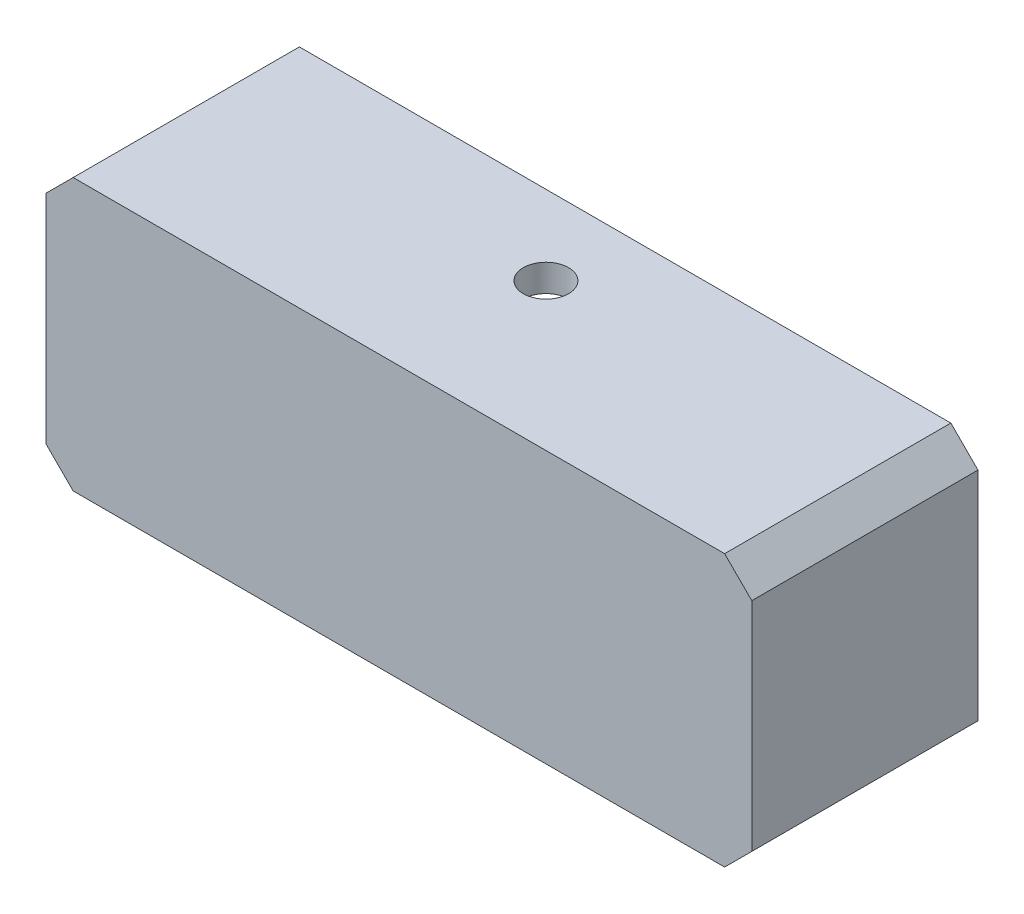
from build123d import *

# Parameters (mm, degrees)
SKETCH_1_W               = 70
SKETCH_1_H               = 20
EXTRUDE_1_DEPTH          = 3
SKETCH_2_W               = 78
SKETCH_2_H               = 30
EXTRUDE_2_DEPTH          = 3
SKETCH_4_W               = 16
SKETCH_4_H               = 12
SKETCH_4_W_2             = 9.1
SKETCH_4_H_2             = 6.5
EXTRUDE_3_DEPTH          = 22
SKETCH_5_W               = 46
SKETCH_5_H               = 3
EXTRUDE_4_DEPTH          = 22
EXTRUDE_5_DEPTH          = 22
CHAMFER_1_SIZE           = 3
CUT_EXTRUDE_1_DEPTH      = 82.786306922
CUT_EXTRUDE_1_DEPTH_BACK = 82.786306922
SKETCH_10_R              = 2.5
SKETCH_11_R              = 1.65
CUT_EXTRUDE_2_DEPTH      = 10


with BuildPart() as part:
    # 草图1 → 凸台-拉伸1 (new body)
    with BuildSketch(Plane.XY):
        with Locations((35, 10)):
            Rectangle(SKETCH_1_W, SKETCH_1_H)
    extrude(amount=EXTRUDE_1_DEPTH)

    # 草图2 → 凸台-拉伸2 (add)
    with BuildSketch(Plane.XY.offset(3)):
        with Locations((35, 12)):
            Rectangle(SKETCH_2_W, SKETCH_2_H)
    extrude(amount=-EXTRUDE_2_DEPTH)

    # 草图4 → 凸台-拉伸3 (add)
    with BuildSketch(Plane(origin=(0, 0, 0), x_dir=(-1, 0, 0), z_dir=(0, 0, -1))):
        with Locations((-66, 3)):
            Rectangle(SKETCH_4_W, SKETCH_4_H)
        with Locations((-65.45, 3.25)):
            Rectangle(SKETCH_4_W_2, SKETCH_4_H_2, mode=Mode.SUBTRACT)
    extrude_3 = extrude(amount=EXTRUDE_3_DEPTH)

    # 镜向1: 凸台-拉伸3 across plane
    add(extrude_3.mirror(Plane(origin=(35, 0, 0), x_dir=(0, 0, 1), z_dir=(1, 0, 0))))

    # 草图5 → 凸台-拉伸4 (add)
    with BuildSketch(Plane(origin=(0, 0, 0), x_dir=(-1, 0, 0), z_dir=(0, 0, -1))):
        with Locations((-35, -1.5)):
            Rectangle(SKETCH_5_W, SKETCH_5_H)
    extrude(amount=EXTRUDE_4_DEPTH)

    # 草图6 → 凸台-拉伸5 (add)
    with BuildSketch(Plane(origin=(0, 0, 0), x_dir=(-1, 0, 0), z_dir=(0, 0, -1))):
        Polygon((4, 27), (-74, 27), (-74, 24), (-74, 9), (-71, 9), (-71, 24), (1, 24), (1, 9), (4, 9), (4, 24), align=None)
    extrude(amount=EXTRUDE_5_DEPTH)

    # 倒角1
    chamfer_1_edges = [part.edges().sort_by_distance(p)[0] for p in [
        (-4, -3, -9.5),
        (-4, 27, -9.5),
        (74, 27, -9.5),
        (74, -3, -9.5),
    ]]
    chamfer(chamfer_1_edges, length=CHAMFER_1_SIZE)

    # 草图10 → 切除-拉伸1 (cut, two sides: drawn at the far end of the back side and taken through both)
    with BuildSketch(Plane.XZ.offset(-24).offset(-CUT_EXTRUDE_1_DEPTH_BACK)):
        with Locations((35, -13.25)):
            Circle(SKETCH_10_R)
    extrude(amount=CUT_EXTRUDE_1_DEPTH + CUT_EXTRUDE_1_DEPTH_BACK, mode=Mode.SUBTRACT)

    # 草图11 → 切除-拉伸2 (cut, symmetric)
    with BuildSketch(Plane.XZ.offset(-6.5)):
        with Locations(Location((4.55, -8, 0), (0, 0, 180))):
            Circle(SKETCH_11_R)
    cut_extrude_2 = extrude(amount=CUT_EXTRUDE_2_DEPTH, both=True, mode=Mode.SUBTRACT)

    # 镜向2: 切除-拉伸2 across plane
    add(cut_extrude_2.mirror(Plane(origin=(35, 0, 0), x_dir=(0, 0, 1), z_dir=(1, 0, 0))), mode=Mode.SUBTRACT)


solid = part.part
